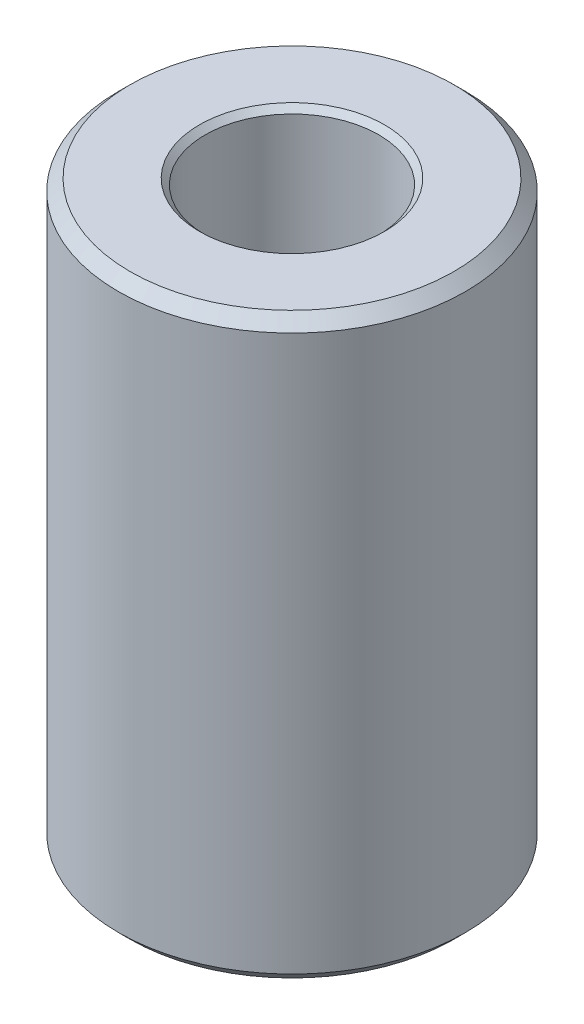
from build123d import *

# Parameters (mm, degrees)
SKETCH_1_R          = 3
EXTRUDE_1_DEPTH     = 10
SKETCH_2_R          = 1
CUT_EXTRUDE_1_DEPTH = 5
CUT_EXTRUDE_START   = 10
SKETCH_3_R          = 1.5
CUT_EXTRUDE_2_DEPTH = 5
CHAMFER_1_SIZE      = 0.2
CHAMFER_2_SIZE      = 0.1


with BuildPart() as part:
    # 草图1 → 凸台-拉伸1 (new body)
    with BuildSketch(Plane(origin=(0, 0, 0), x_dir=(1, 0, 0), z_dir=(0, 1, 0))):
        with Locations(Location((0, 0, 0), (0, 0, 270))):
            Circle(SKETCH_1_R)
    extrude(amount=EXTRUDE_1_DEPTH)

    # 草图2 → 切除-拉伸1 (cut)
    with BuildSketch(Plane(origin=(0, 0, 0), x_dir=(1, 0, 0), z_dir=(0, 1, 0))):
        with Locations(Location((0, 0, 0), (0, 0, 270))):
            Circle(SKETCH_2_R)
    extrude(amount=CUT_EXTRUDE_1_DEPTH, mode=Mode.SUBTRACT)

    # 草图3 → 切除-拉伸2 (cut)
    with BuildSketch(Plane(origin=(0, 0, 0), x_dir=(1, 0, 0), z_dir=(0, 1, 0)).offset(CUT_EXTRUDE_START)):
        with Locations(Location((0, 0, 0), (0, 0, 270))):
            Circle(SKETCH_3_R)
    extrude(amount=-CUT_EXTRUDE_2_DEPTH, mode=Mode.SUBTRACT)

    # 倒角1
    chamfer_1_edges = [part.edges().sort_by_distance(p)[0] for p in [
        (0, 0, -3),
        (0, 10, -3),
    ]]
    chamfer(chamfer_1_edges, length=CHAMFER_1_SIZE)

    # 倒角2
    chamfer_2_edges = [part.edges().sort_by_distance(p)[0] for p in [
        (0, 10, -1.5),
        (0, 0, -1),
    ]]
    chamfer(chamfer_2_edges, length=CHAMFER_2_SIZE)


solid = part.part
